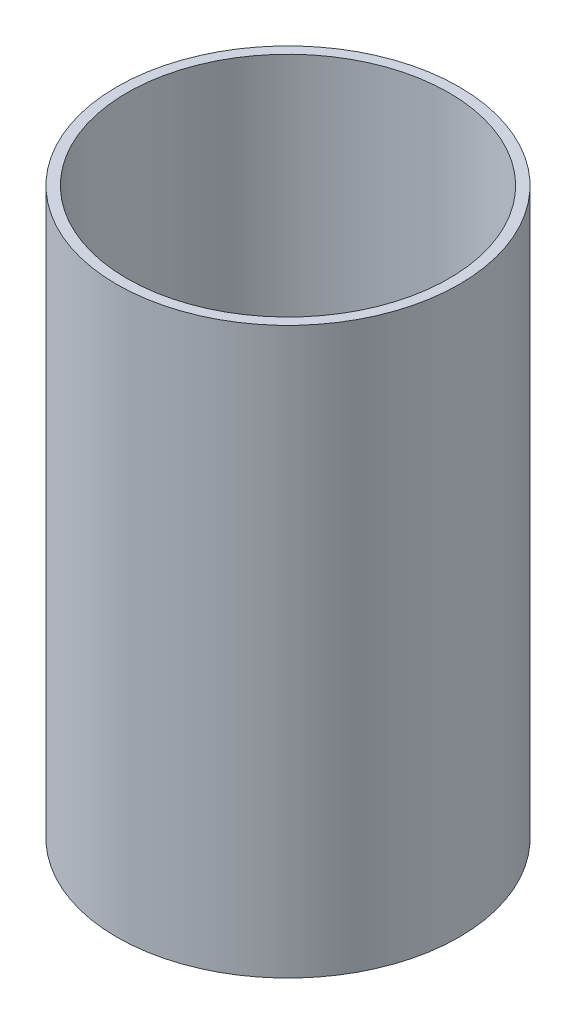
from build123d import *

# Parameters (mm, degrees)
SKETCH1_R           = 25.175
SKETCH1_R_2         = 23.675
BOSS_EXTRUDE1_DEPTH = 83.14


with BuildPart() as part:
    # Sketch1 → Boss-Extrude1 (new body)
    with BuildSketch(Plane(origin=(0, 0, 0), x_dir=(1, 0, 0), z_dir=(0, 1, 0))):
        with Locations(Location((0, 0, 0), (0, 0, 270))):
            Circle(SKETCH1_R)
        with Locations(Location((0, 0, 0), (0, 0, 270))):
            Circle(SKETCH1_R_2, mode=Mode.SUBTRACT)
    extrude(amount=BOSS_EXTRUDE1_DEPTH)


solid = part.part
